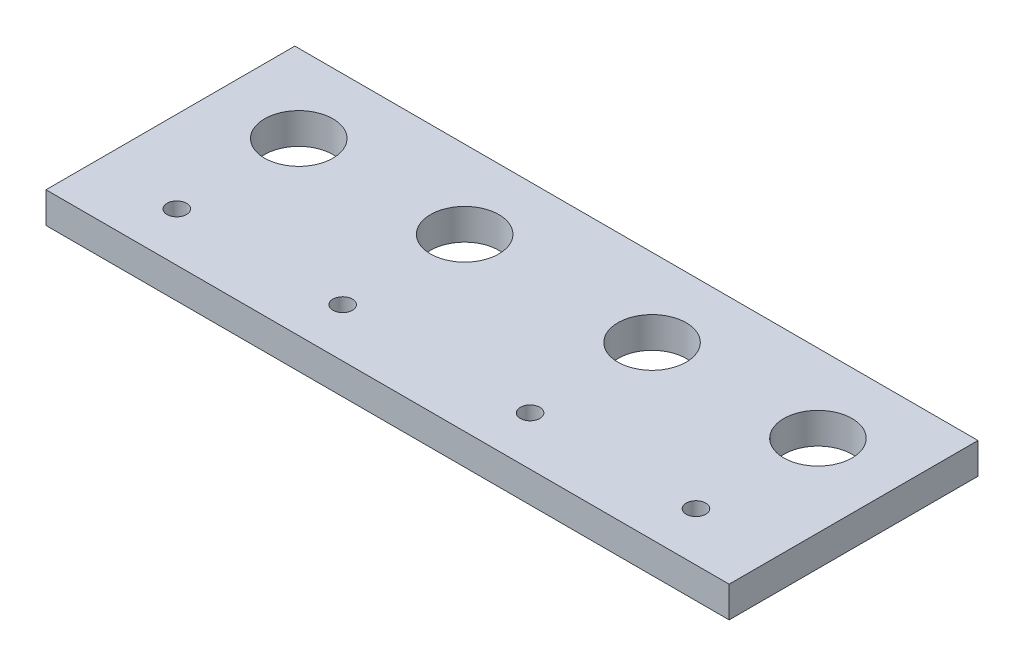
from build123d import *

# Parameters (mm, degrees)
SKETCH1_W           = 140
SKETCH1_H           = 51
SKETCH1_R           = 2
SKETCH1_R_2         = 7
BOSS_EXTRUDE1_DEPTH = 6.35


with BuildPart() as part:
    # Sketch1 → Boss-Extrude1 (new body)
    with BuildSketch(Plane(origin=(0, 0, 0), x_dir=(1, 0, 0), z_dir=(0, 1, 0))):
        with Locations((0, -25.5)):
            Rectangle(SKETCH1_W, SKETCH1_H)
        with Locations(Location((53.2, -41, 0), (0, 0, 270))):
            Circle(SKETCH1_R, mode=Mode.SUBTRACT)
        with Locations(Location((-53.2, -41, 0), (0, 0, 270))):
            Circle(SKETCH1_R, mode=Mode.SUBTRACT)
        with Locations(Location((-19.2, -41, 0), (0, 0, 270))):
            Circle(SKETCH1_R, mode=Mode.SUBTRACT)
        with Locations(Location((19.2, -41, 0), (0, 0, 270))):
            Circle(SKETCH1_R, mode=Mode.SUBTRACT)
        with Locations(Location((-53.2, -16, 0), (0, 0, 270))):
            Circle(SKETCH1_R_2, mode=Mode.SUBTRACT)
        with Locations(Location((-19.2, -16, 0), (0, 0, 270))):
            Circle(SKETCH1_R_2, mode=Mode.SUBTRACT)
        with Locations(Location((19.2, -16, 0), (0, 0, 270))):
            Circle(SKETCH1_R_2, mode=Mode.SUBTRACT)
        with Locations(Location((53.2, -16, 0), (0, 0, 270))):
            Circle(SKETCH1_R_2, mode=Mode.SUBTRACT)
    extrude(amount=BOSS_EXTRUDE1_DEPTH)


solid = part.part
